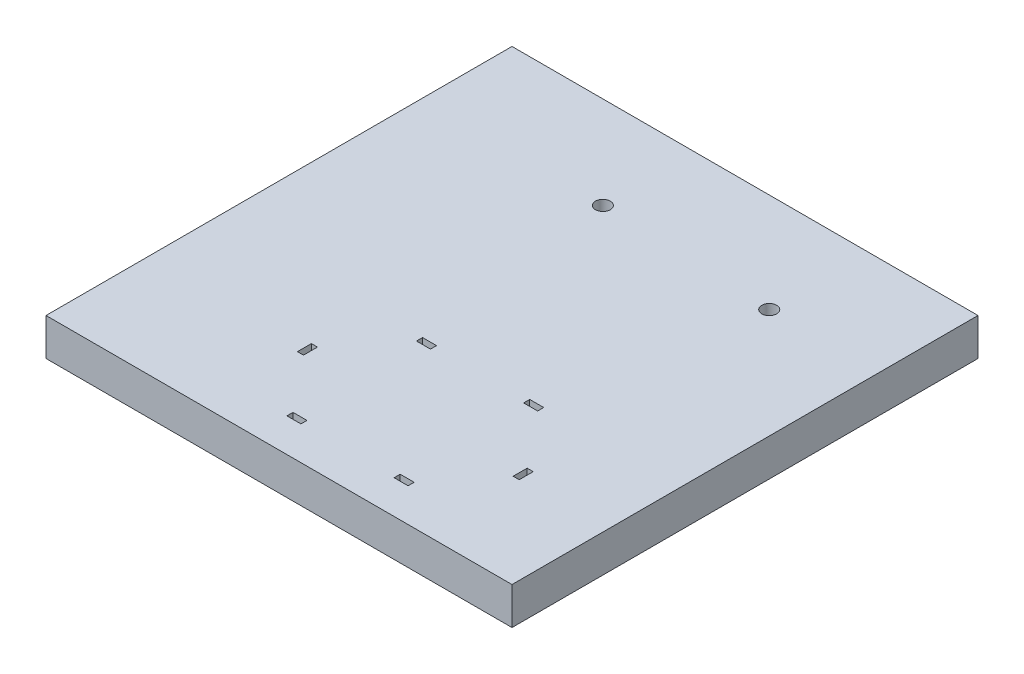
from build123d import *

# Parameters (mm, degrees)
SKETCH1_W           = 100
SKETCH1_H           = 100
SKETCH1_R           = 1.6
SKETCH1_W_2         = 3
SKETCH1_H_2         = 1.3
SKETCH1_W_3         = 1.3
SKETCH1_H_3         = 3
BOSS_EXTRUDE1_DEPTH = 8


with BuildPart() as part:
    # Sketch1 → Boss-Extrude1 (new body)
    with BuildSketch(Plane(origin=(0, 0, 0), x_dir=(1, 0, 0), z_dir=(0, 1, 0))):
        Rectangle(SKETCH1_W, SKETCH1_H)
        with Locations(Location((26.5, 28.7, 0), (0, 0, 270))):
            Circle(SKETCH1_R, mode=Mode.SUBTRACT)
        with Locations(Location((-10.7, 30.2, 0), (0, 0, 270))):
            Circle(SKETCH1_R, mode=Mode.SUBTRACT)
        with Locations((19, -14.35)):
            Rectangle(SKETCH1_W_2, SKETCH1_H_2, mode=Mode.SUBTRACT)
        with Locations((-4, -14.35)):
            Rectangle(SKETCH1_W_2, SKETCH1_H_2, mode=Mode.SUBTRACT)
        with Locations((-15.65, -28.25)):
            Rectangle(SKETCH1_W_3, SKETCH1_H_3, mode=Mode.SUBTRACT)
        with Locations((30.65, -28.25)):
            Rectangle(SKETCH1_W_3, SKETCH1_H_3, mode=Mode.SUBTRACT)
        with Locations((19, -42.15)):
            Rectangle(SKETCH1_W_2, SKETCH1_H_2, mode=Mode.SUBTRACT)
        with Locations((-4, -42.15)):
            Rectangle(SKETCH1_W_2, SKETCH1_H_2, mode=Mode.SUBTRACT)
    extrude(amount=BOSS_EXTRUDE1_DEPTH)


solid = part.part
